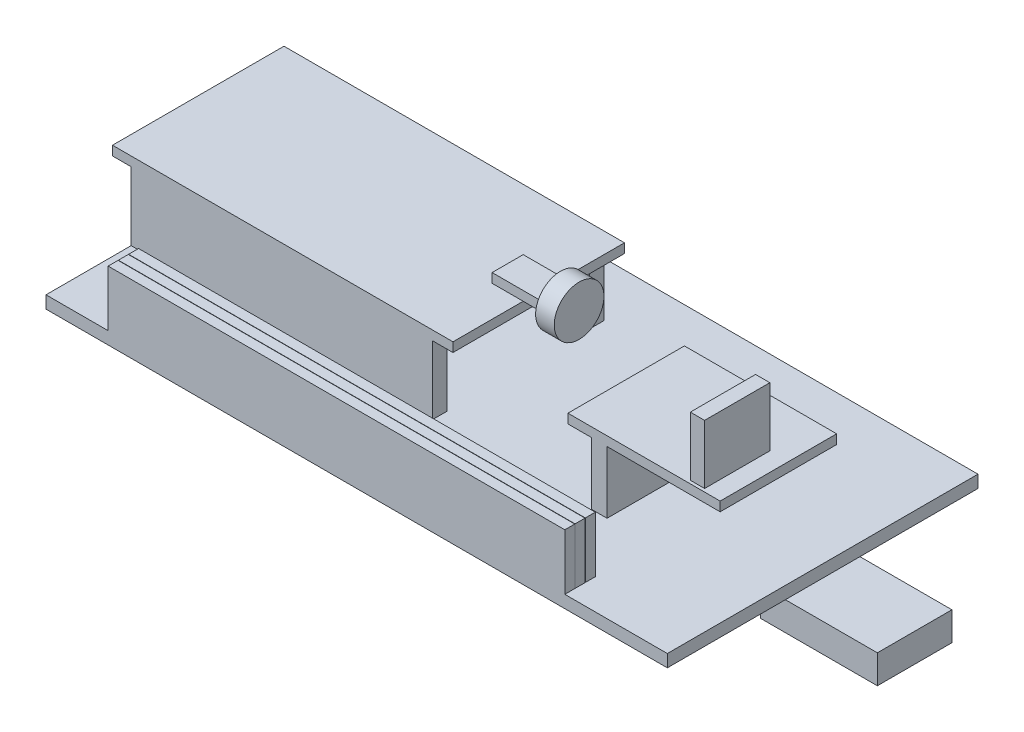
from build123d import *

# Parameters (mm, degrees)
SKETCH1_W            = 100
SKETCH1_H            = 50
BOSS_EXTRUDE1_DEPTH  = 2
SKETCH2_W            = 73.5
SKETCH2_H            = 1.6
BOSS_EXTRUDE2_DEPTH  = 9
LPATTERN2_COUNT      = 3
LPATTERN2_PITCH      = 1.65
SKETCH3_W            = 18.8
SKETCH3_H            = 12
BOSS_EXTRUDE3_DEPTH  = 4.6
SKETCH4_W            = 48.5
SKETCH4_H            = 2.3
BOSS_EXTRUDE4_DEPTH  = 11
SKETCH5_W            = 54.8
SKETCH5_H            = 27.6
BOSS_EXTRUDE5_DEPTH  = 1.5
SKETCH6_W            = 8.5
SKETCH6_H            = 5
BOSS_EXTRUDE6_DEPTH  = 1.5
SKETCH7_R            = 4
BOSS_EXTRUDE7_DEPTH  = 3
SKETCH8_W            = 2.5
SKETCH8_H            = 10.5
SKETCH8_H_2          = 5.25
BOSS_EXTRUDE8_DEPTH  = 10
SKETCH9_W            = 24.5
SKETCH9_H            = 18.75
BOSS_EXTRUDE9_DEPTH  = 1.5
SKETCH10_W           = 2.3
SKETCH10_H           = 10.5
BOSS_EXTRUDE10_DEPTH = 9.5


with BuildPart() as part:
    # Sketch1 → Boss-Extrude1 (new body)
    with BuildSketch(Plane(origin=(0, 0, 0), x_dir=(1, 0, 0), z_dir=(0, 1, 0))):
        Rectangle(SKETCH1_W, SKETCH1_H)
    extrude(amount=BOSS_EXTRUDE1_DEPTH)

    # Sketch2 → Boss-Extrude2 (add)
    with BuildSketch(Plane(origin=(0, 2, 0), x_dir=(1, 0, 0), z_dir=(0, 1, 0))):
        with Locations((-3.25, -24.2)):
            Rectangle(SKETCH2_W, SKETCH2_H)
    boss_extrude2 = extrude(amount=BOSS_EXTRUDE2_DEPTH)

    # LPattern2: Boss-Extrude2 ×3
    with Locations(*[(0, 0, -i * LPATTERN2_PITCH) for i in range(1, LPATTERN2_COUNT)]):
        add(boss_extrude2)

    # Sketch3 → Boss-Extrude3 (add)
    with BuildSketch(Plane.XZ):
        with Locations((55.4, 0)):
            Rectangle(SKETCH3_W, SKETCH3_H)
    extrude(amount=BOSS_EXTRUDE3_DEPTH)

    # Sketch4 → Boss-Extrude4 (add)
    with BuildSketch(Plane(origin=(0, 2, 0), x_dir=(1, 0, 0), z_dir=(0, 1, 0))):
        with Locations((-25.75, -10.15)):
            Rectangle(SKETCH4_W, SKETCH4_H)
        with Locations((-25.75, 15.15)):
            Rectangle(SKETCH4_W, SKETCH4_H)
    extrude(amount=BOSS_EXTRUDE4_DEPTH)

    # Sketch5 → Boss-Extrude5 (add)
    with BuildSketch(Plane(origin=(0, 13, 0), x_dir=(1, 0, 0), z_dir=(0, 1, 0))):
        with Locations((-25.6, 2.5)):
            Rectangle(SKETCH5_W, SKETCH5_H)
    extrude(amount=BOSS_EXTRUDE5_DEPTH)

    # Sketch6 → Boss-Extrude6 (add)
    with BuildSketch(Plane(origin=(0, 14.5, 0), x_dir=(1, 0, 0), z_dir=(0, 1, 0))):
        with Locations((1.05, 2.5)):
            Rectangle(SKETCH6_W, SKETCH6_H)
    extrude(amount=BOSS_EXTRUDE6_DEPTH)

    # Sketch7 → Boss-Extrude7 (add)
    with BuildSketch(Plane(origin=(5.3, 0, 0), x_dir=(0, 0, -1), z_dir=(1, 0, 0))):
        with Locations((2.5, 15.179402112)):
            Circle(SKETCH7_R)
    extrude(amount=BOSS_EXTRUDE7_DEPTH)

    # Sketch8 → Boss-Extrude8 (add)
    with BuildSketch(Plane(origin=(0, 2, 0), x_dir=(1, 0, 0), z_dir=(0, 1, 0))):
        with Locations((25.05, -5.75)):
            Rectangle(SKETCH8_W, SKETCH8_H)
        with Locations((21.25, 5.125)):
            Rectangle(SKETCH8_W, SKETCH8_H_2)
    extrude(amount=BOSS_EXTRUDE8_DEPTH)

    # Sketch9 → Boss-Extrude9 (add)
    with BuildSketch(Plane(origin=(0, 12, 0), x_dir=(1, 0, 0), z_dir=(0, 1, 0))):
        with Locations((32.25, -1.625)):
            Rectangle(SKETCH9_W, SKETCH9_H)
    extrude(amount=BOSS_EXTRUDE9_DEPTH)

    # Sketch10 → Boss-Extrude10 (add)
    with BuildSketch(Plane(origin=(0, 13.5, 0), x_dir=(1, 0, 0), z_dir=(0, 1, 0))):
        with Locations((40.35, -5.25)):
            Rectangle(SKETCH10_W, SKETCH10_H)
    extrude(amount=BOSS_EXTRUDE10_DEPTH)


solid = part.part
